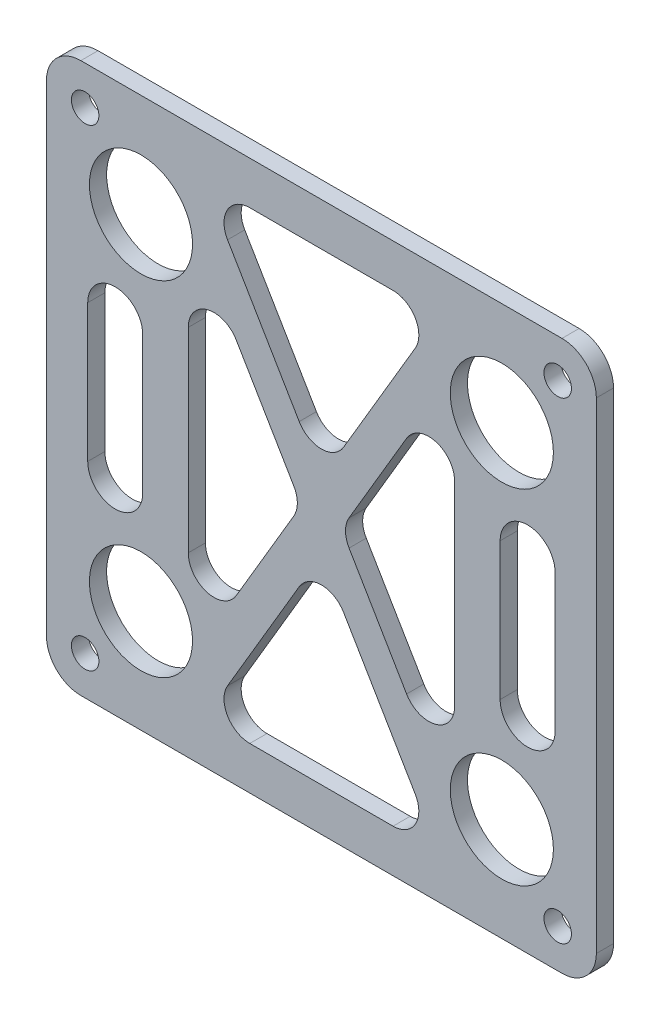
from build123d import *

# Parameters (mm, degrees)
SKETCH_1_W          = 64
SKETCH_1_H          = 64
EXTRUDE_1_DEPTH     = 2
SKETCH_2_R          = 1.6
CUT_EXTRUDE_1_DEPTH = 2
FILLET_1_R          = 4
CUT_EXTRUDE_2_DEPTH = 10
CUT_EXTRUDE_3_DEPTH = 10
FILLET_2_R          = 3
SKETCH_5_R          = 6
CUT_EXTRUDE_4_DEPTH = 10


with BuildPart() as part:
    # 草图1 → 凸台-拉伸1 (new body)
    with BuildSketch(Plane.XY):
        Rectangle(SKETCH_1_W, SKETCH_1_H)
    extrude(amount=EXTRUDE_1_DEPTH)

    # 草图2 → 切除-拉伸1 (cut)
    with BuildSketch(Plane.XY.offset(2)):
        with Locations((-27.5, -27.5)):
            Circle(SKETCH_2_R)
        with Locations((-27.5, 27.5)):
            Circle(SKETCH_2_R)
        with Locations(Location((27.5, -27.5, 0), (0, 0, 180))):
            Circle(SKETCH_2_R)
        with Locations(Location((27.5, 27.5, 0), (0, 0, 180))):
            Circle(SKETCH_2_R)
    extrude(amount=-CUT_EXTRUDE_1_DEPTH, mode=Mode.SUBTRACT)

    # 圆角1
    fillet_1_edges = [part.edges().sort_by_distance(p)[0] for p in [
        (32, -32, 1),
        (-32, -32, 1),
        (-32, 32, 1),
        (32, 32, 1),
    ]]
    fillet(fillet_1_edges, radius=FILLET_1_R)

    # 草图3 → 切除-拉伸2 (cut)
    with BuildSketch(Plane.XY.offset(2)):
        with BuildLine():
            Line((-20.8, 8), (-20.8, -8))
            ThreePointArc((-20.8, -8), (-24, -11.2), (-27.2, -8))
            Line((-27.2, -8), (-27.2, 8))
            ThreePointArc((-27.2, 8), (-24, 11.2), (-20.8, 8))
        make_face()
        with BuildLine():
            Line((20.8, 8), (20.8, -8))
            ThreePointArc((20.8, -8), (24, -11.2), (27.2, -8))
            Line((27.2, -8), (27.2, 8))
            ThreePointArc((27.2, 8), (24, 11.2), (20.8, 8))
        make_face()
    extrude(amount=-CUT_EXTRUDE_2_DEPTH, mode=Mode.SUBTRACT)

    # 草图4 → 切除-拉伸3 (cut)
    with BuildSketch(Plane.XY.offset(2)):
        Polygon((-15.498284962, 22.363155997), (-15.498284962, -22.363155997), (-2.32136638, 0), align=None)
        Polygon((-13.587694119, -27), (13.587694119, -27), (0, -3.939697902), align=None)
        Polygon((2.32136638, 0), (15.498284962, 22.363155997), (15.498284962, -22.363155997), align=None)
        Polygon((0, 3.939697902), (-13.587694119, 27), (13.587694119, 27), align=None)
    extrude(amount=-CUT_EXTRUDE_3_DEPTH, mode=Mode.SUBTRACT)

    # 圆角2
    fillet_2_edges = [part.edges().sort_by_distance(p)[0] for p in [
        (15.498284962, -22.363155997, 1),
        (2.32136638, 0, 1),
        (15.498284962, 22.363155997, 1),
        (-13.587694119, -27, 1),
        (0, -3.939697902, 1),
        (13.587694119, -27, 1),
        (13.587694119, 27, 1),
        (0, 3.939697902, 1),
        (-13.587694119, 27, 1),
        (-2.32136638, 0, 1),
        (-15.498284962, -22.363155997, 1),
        (-15.498284962, 22.363155997, 1),
    ]]
    fillet(fillet_2_edges, radius=FILLET_2_R)

    # 草图5 → 切除-拉伸4 (cut)
    with BuildSketch(Plane.XY.offset(2)):
        with Locations((21, 20)):
            Circle(SKETCH_5_R)
        with Locations((-21, 20)):
            Circle(SKETCH_5_R)
        with Locations((21, -20)):
            Circle(SKETCH_5_R)
        with Locations((-21, -20)):
            Circle(SKETCH_5_R)
    extrude(amount=-CUT_EXTRUDE_4_DEPTH, mode=Mode.SUBTRACT)


solid = part.part
